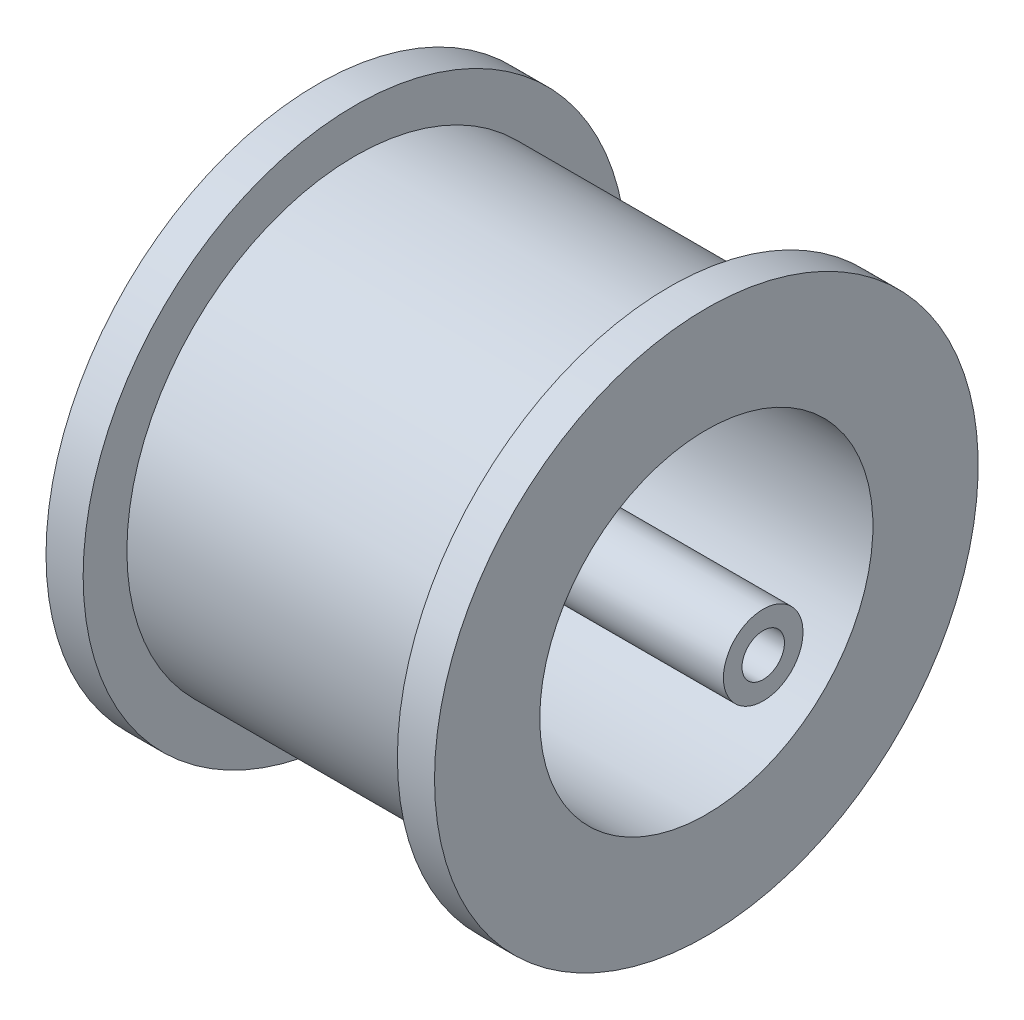
from build123d import *

# Parameters (mm, degrees)
SKETCH6_R          = 0.8
CUT_EXTRUDE1_DEPTH = 10
CUT_EXTRUDE2_DEPTH = 10


with BuildPart() as part:
    # Sketch1 → Revolve1 (revolve)
    with BuildSketch(Plane.XY, mode=Mode.PRIVATE) as revolve1_sk:
        Polygon((0, 10.25), (0, 6.5), (2.6, 6.5), (2.6, 5), (4.6, 5), (4.6, 6.281355932), (14.65, 6.281355932), (14.65, 10.25), (13.25, 10.25), (13.25, 8.6), (1.4, 8.6), (1.4, 10.25), align=None)
    revolve(revolve1_sk.sketch.rotate(Axis((0, 0, 0), (1, 0, 0)), 90), axis=Axis((0, 0, 0), (1, 0, 0)))



with BuildPart() as body_2:
    # Sketch3 → Revolve2 (revolve)
    with BuildSketch(Plane.XY, mode=Mode.PRIVATE) as revolve2_sk:
        Polygon((1.094302339, 0), (1.094302339, 3.76292134), (5.013797074, 1.5), (16.794302339, 1.5), (16.794302339, 0), align=None)
    revolve(revolve2_sk.sketch.rotate(Axis((0, 0, 0), (1, 0, 0)), 90), axis=Axis((0, 0, 0), (1, 0, 0)))

    # Sketch6 → Cut-Extrude1 (cut)
    with BuildSketch(Plane(origin=(16.794302339, 0, 0), x_dir=(0, 0, -1), z_dir=(1, 0, 0))):
        Circle(SKETCH6_R)
    extrude(amount=-CUT_EXTRUDE1_DEPTH, mode=Mode.SUBTRACT)


with BuildPart() as part_1:
    add(part.part)

    add(body_2.part)  # Revolve3 merges body 2
    # Sketch8 → Revolve3 (revolve)
    with BuildSketch(Plane.XY, mode=Mode.PRIVATE) as revolve3_sk:
        Polygon((0, 0), (0, 5), (2.6, 6.5), (2.6, 4.723965443), (1.094302339, 3.854650493), (1.094302339, 0), align=None)
    revolve(revolve3_sk.sketch.rotate(Axis((0, 0, 0), (1, 0, 0)), 90), axis=Axis((0, 0, 0), (1, 0, 0)))

    # Sketch9 → Cut-Extrude2 (cut)
    with BuildSketch(Plane.ZY):
        with BuildLine():
            Line((1.060952343, 2), (-1.060952343, 2))
            Line((-1.060952343, 2), (-2.811396527, 4.086098145))
            ThreePointArc((-2.811396527, 4.086098145), (0, 4.959853676), (2.811396527, 4.086098145))
            Line((2.811396527, 4.086098145), (1.060952343, 2))
        make_face()
        with BuildLine():
            Line((2, 1.060952343), (4.086098145, 2.811396527))
            ThreePointArc((4.086098145, 2.811396527), (4.959853676, 0), (4.086098145, -2.811396527))
            Line((4.086098145, -2.811396527), (2, -1.060952343))
            Line((2, -1.060952343), (2, 1.060952343))
        make_face()
        with BuildLine():
            Line((1.060952343, -2), (2.811396527, -4.086098145))
            ThreePointArc((2.811396527, -4.086098145), (0, -4.959853676), (-2.811396527, -4.086098145))
            Line((-2.811396527, -4.086098145), (-1.060952343, -2))
            Line((-1.060952343, -2), (1.060952343, -2))
        make_face()
        with BuildLine():
            Line((-2, -1.060952343), (-4.086098145, -2.811396527))
            ThreePointArc((-4.086098145, -2.811396527), (-4.959853676, 0), (-4.086098145, 2.811396527))
            Line((-4.086098145, 2.811396527), (-2, 1.060952343))
            Line((-2, 1.060952343), (-2, -1.060952343))
        make_face()
    extrude(amount=-CUT_EXTRUDE2_DEPTH, mode=Mode.SUBTRACT)


solid = part_1.part
